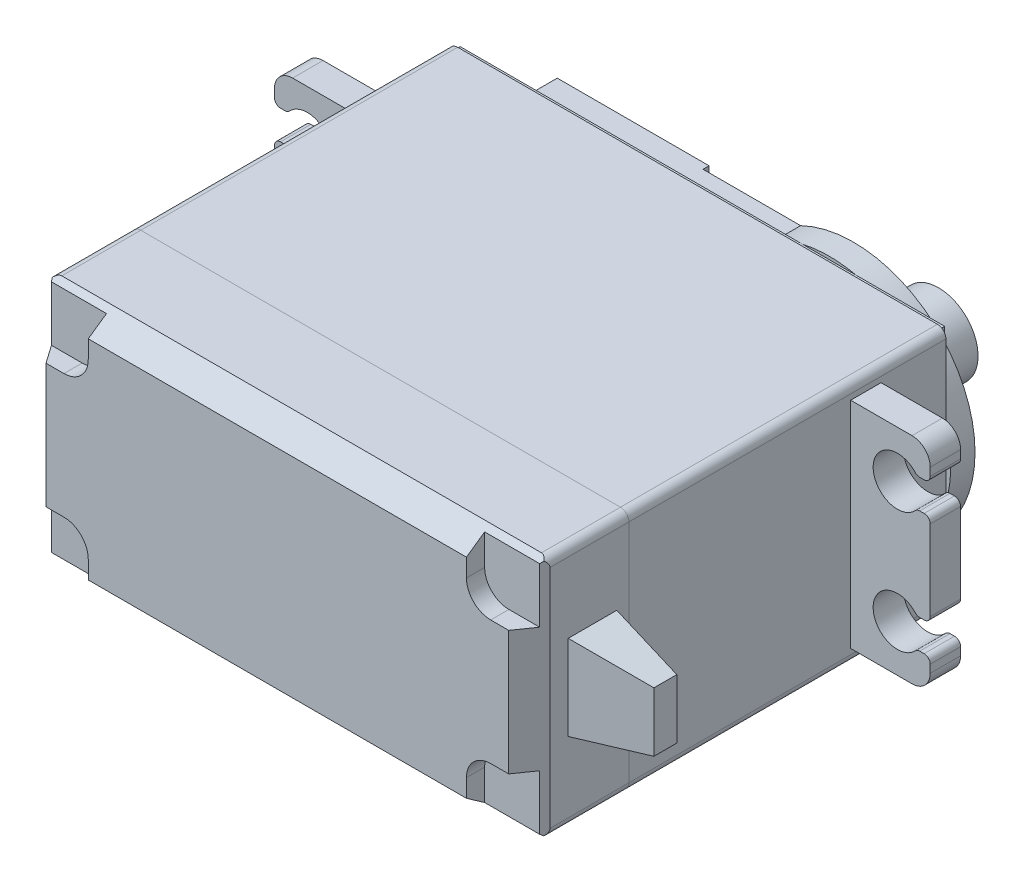
from build123d import *
from OCP.BRepFilletAPI import BRepFilletAPI_MakeChamfer

# Parameters (mm, degrees)
SKETCH1_W            = 40.9
SKETCH1_H            = 20
BOSS_EXTRUDE1_DEPTH  = 19.3
SKETCH3_W            = 40.9
SKETCH3_H            = 20
BOSS_EXTRUDE2_DEPTH  = 6.8
SKETCH4_W            = 40.9
SKETCH4_H            = 20
BOSS_EXTRUDE3_DEPTH  = 8.5
CHAMFER1_SIZE        = 2
CHAMFER1_SIZE2       = 1.400415076
CUT_EXTRUDE1_DEPTH   = 1.5
SKETCH6_W            = 39.9
SKETCH6_H            = 19.5
BOSS_EXTRUDE4_DEPTH  = 0.4
BOSS_EXTRUDE5_DEPTH  = 2
SKETCH8_R            = 6.5
BOSS_EXTRUDE6_DEPTH  = 1.5
SKETCH9_R            = 5.5
BOSS_EXTRUDE8_DEPTH  = 0.5
SKETCH11_R           = 3.25
BOSS_EXTRUDE9_DEPTH  = 5
SKETCH12_W           = 10.5
SKETCH12_H           = 15.998933302
BOSS_EXTRUDE10_DEPTH = 0.5
FILLET1_R            = 0.7
FILLET2_R            = 0.7
FILLET3_R            = 0.7
BOSS_EXTRUDE11_START = -5.74
BOSS_EXTRUDE11_DEPTH = 2.5
SKETCH14_W           = 4
SKETCH14_H           = 7
BOSS_EXTRUDE12_DEPTH = 6
BOSS_EXTRUDE12_TAPER = 10


with BuildPart() as part:
    # Sketch1 → Boss-Extrude1 (new body)
    with BuildSketch(Plane.XY):
        Rectangle(SKETCH1_W, SKETCH1_H)
    extrude(amount=BOSS_EXTRUDE1_DEPTH)

    # Fillet1
    fillet1_edges = [part.edges().sort_by_distance(p)[0] for p in [
        (-20.45, 10, 9.65),
        (20.45, 10, 9.65),
        (20.45, -10, 9.65),
        (-20.45, -10, 9.65),
    ]]
    fillet(fillet1_edges, radius=FILLET1_R)



with BuildPart() as body_2:
    # Sketch3 → Boss-Extrude2 (new body)
    with BuildSketch(Plane(origin=(0, 0, 0), x_dir=(-1, 0, 0), z_dir=(0, 0, -1))):
        Rectangle(SKETCH3_W, SKETCH3_H)
    extrude(amount=BOSS_EXTRUDE2_DEPTH)

    # Sketch6 → Boss-Extrude4 (add)
    with BuildSketch(Plane(origin=(0, 0, -6.8), x_dir=(-1, 0, 0), z_dir=(0, 0, -1))):
        Rectangle(SKETCH6_W, SKETCH6_H)
    extrude(amount=BOSS_EXTRUDE4_DEPTH)

    # Sketch7 → Boss-Extrude5 (add)
    with BuildSketch(Plane(origin=(0, 0, -7.2), x_dir=(-1, 0, 0), z_dir=(0, 0, -1))):
        with BuildLine():
            Line((-6.09, 8.999466651), (14.45, 8.999466651))
            Line((14.45, 8.999466651), (14.45, 3))
            ThreePointArc((14.45, 3), (17.45, 0), (14.45, -3))
            Line((14.45, -3), (14.45, -8.999466651))
            Line((14.45, -8.999466651), (-6.09, -8.999466651))
            ThreePointArc((-6.09, -8.999466651), (-20.45, 0), (-6.09, 8.999466651))
        make_face()
    extrude(amount=BOSS_EXTRUDE5_DEPTH)

    # Sketch8 → Boss-Extrude6 (add)
    with BuildSketch(Plane(origin=(0, 0, -9.2), x_dir=(-1, 0, 0), z_dir=(0, 0, -1))):
        with Locations((-10.45, 0)):
            Circle(SKETCH8_R)
    extrude(amount=BOSS_EXTRUDE6_DEPTH)

    # Sketch9 → Boss-Extrude8 (add)
    with BuildSketch(Plane(origin=(0, 0, -10.7), x_dir=(-1, 0, 0), z_dir=(0, 0, -1))):
        with Locations((-10.45, 0)):
            Circle(SKETCH9_R)
    extrude(amount=BOSS_EXTRUDE8_DEPTH)

    # Sketch11 → Boss-Extrude9 (add)
    with BuildSketch(Plane(origin=(0, 0, -11.2), x_dir=(-1, 0, 0), z_dir=(0, 0, -1))):
        with Locations((-10.45, 0)):
            Circle(SKETCH11_R)
    extrude(amount=BOSS_EXTRUDE9_DEPTH)

    # Sketch12 → Boss-Extrude10 (add)
    with BuildSketch(Plane(origin=(0, 0, -9.2), x_dir=(-1, 0, 0), z_dir=(0, 0, -1))):
        with BuildLine():
            Line((14.45, 8.999466651), (1.95, 8.999466651))
            Line((1.95, 8.999466651), (1.95, 1.75))
            ThreePointArc((1.95, 1.75), (0.2, 0), (1.95, -1.75))
            Line((1.95, -1.75), (1.95, -8.999466651))
            Line((1.95, -8.999466651), (14.45, -8.999466651))
            Line((14.45, -8.999466651), (14.45, 8.999466651))
        make_face()
        with Locations((8.2, 0)):
            Rectangle(SKETCH12_W, SKETCH12_H, mode=Mode.SUBTRACT)
    extrude(amount=BOSS_EXTRUDE10_DEPTH)

    # Fillet2
    fillet2_edges = [body_2.edges().sort_by_distance(p)[0] for p in [
        (20.45, -10, -3.4),
        (20.45, 10, -3.4),
        (-20.45, 10, -3.4),
        (-20.45, -10, -3.4),
    ]]
    fillet(fillet2_edges, radius=FILLET2_R)


with BuildPart() as body_3:
    # Sketch4 → Boss-Extrude3 (new body)
    with BuildSketch(Plane.XY.offset(19.3)):
        Rectangle(SKETCH4_W, SKETCH4_H)
    extrude(amount=BOSS_EXTRUDE3_DEPTH)

    # Chamfer1: one chamfer whose edges measure the first distance from different faces: ONE call of the kernel's chamfer builder (chamfer() names one face for all edges)
    chamfer1_edges_1 = [body_3.edges().sort_by_distance(p)[0] for p in [
        (0, -10, 27.8),
    ]]
    chamfer1_side_1 = [body_3.faces().sort_by_distance(p)[0] for p in [
        (0, -10, 23.55),
    ]]
    chamfer1_edges_2 = [body_3.edges().sort_by_distance(p)[0] for p in [
        (20.45, 0, 27.8),
    ]]
    chamfer1_side_2 = [body_3.faces().sort_by_distance(p)[0] for p in [
        (20.45, 0, 23.55),
    ]]
    chamfer1_edges_3 = [body_3.edges().sort_by_distance(p)[0] for p in [
        (0, 10, 27.8),
    ]]
    chamfer1_side_3 = [body_3.faces().sort_by_distance(p)[0] for p in [
        (0, 10, 23.55),
    ]]
    chamfer1_edges_4 = [body_3.edges().sort_by_distance(p)[0] for p in [
        (-20.45, 0, 27.8),
    ]]
    chamfer1_side_4 = [body_3.faces().sort_by_distance(p)[0] for p in [
        (-20.45, 0, 23.55),
    ]]
    chamfer1 = BRepFilletAPI_MakeChamfer(body_3.part.solid().wrapped)
    for e in chamfer1_edges_1:
        chamfer1.Add(CHAMFER1_SIZE, CHAMFER1_SIZE2, e.wrapped, chamfer1_side_1[0].wrapped)  # the first distance lies on this face
    for e in chamfer1_edges_2:
        chamfer1.Add(CHAMFER1_SIZE, CHAMFER1_SIZE2, e.wrapped, chamfer1_side_2[0].wrapped)  # the first distance lies on this face
    for e in chamfer1_edges_3:
        chamfer1.Add(CHAMFER1_SIZE, CHAMFER1_SIZE2, e.wrapped, chamfer1_side_3[0].wrapped)  # the first distance lies on this face
    for e in chamfer1_edges_4:
        chamfer1.Add(CHAMFER1_SIZE, CHAMFER1_SIZE2, e.wrapped, chamfer1_side_4[0].wrapped)  # the first distance lies on this face
    add(Compound.cast(chamfer1.Shape()), mode=Mode.REPLACE)

    # Sketch5 → Cut-Extrude1 (cut)
    with BuildSketch(Plane.XY.offset(27.8)):
        with BuildLine():
            Line((-20.45, 10), (-15.57, 10))
            Line((-15.57, 10), (-15.57, 7.12))
            ThreePointArc((-15.57, 7.12), (-16.155786438, 5.705786438), (-17.57, 5.12))
            Line((-17.57, 5.12), (-20.45, 5.12))
            Line((-20.45, 5.12), (-20.45, 10))
        make_face()
        with BuildLine():
            Line((20.45, 5.12), (17.57, 5.12))
            ThreePointArc((17.57, 5.12), (16.155786438, 5.705786438), (15.57, 7.12))
            Line((15.57, 7.12), (15.57, 10))
            Line((15.57, 10), (20.45, 10))
            Line((20.45, 10), (20.45, 5.12))
        make_face()
        with BuildLine():
            Line((-20.45, -5.12), (-17.57, -5.12))
            ThreePointArc((-17.57, -5.12), (-16.155786438, -5.705786438), (-15.57, -7.12))
            Line((-15.57, -7.12), (-15.57, -10))
            Line((-15.57, -10), (-20.45, -10))
            Line((-20.45, -10), (-20.45, -5.12))
        make_face()
        with BuildLine():
            Line((20.45, -10), (20.45, -5.12))
            Line((20.45, -5.12), (17.57, -5.12))
            ThreePointArc((17.57, -5.12), (16.155786438, -5.705786438), (15.57, -7.12))
            Line((15.57, -7.12), (15.57, -10))
            Line((15.57, -10), (20.45, -10))
        make_face()
    extrude(amount=-CUT_EXTRUDE1_DEPTH, mode=Mode.SUBTRACT)

    # Fillet3
    fillet3_edges = [body_3.edges().sort_by_distance(p)[0] for p in [
        (20.45, 10, 22.55),
        (20.45, -10, 22.55),
        (-20.45, -10, 22.55),
        (-20.45, 10, 22.55),
    ]]
    fillet(fillet3_edges, radius=FILLET3_R)

    # Sketch14 → Boss-Extrude12 (add)
    with BuildSketch(Plane(origin=(20.45, 0, 0), x_dir=(0, 0, -1), z_dir=(1, 0, 0))):
        with Locations((-22.3, 0)):
            Rectangle(SKETCH14_W, SKETCH14_H)
    extrude(amount=BOSS_EXTRUDE12_DEPTH, taper=BOSS_EXTRUDE12_TAPER)


with BuildPart() as part_1:
    add(part.part)

    add(body_2.part)  # Boss-Extrude11 merges body 2
    # Sketch13 → Boss-Extrude11 (add)
    with BuildSketch(Plane(origin=(0, 0, -7.2), x_dir=(-1, 0, 0), z_dir=(0, 0, -1)).offset(BOSS_EXTRUDE11_START)):
        with BuildLine():
            Line((20.45, 8.85), (25.5, 8.85))
            ThreePointArc((25.5, 8.85), (26.560660172, 8.410660172), (27, 7.35))
            Line((27, 7.35), (27, 6.7))
            ThreePointArc((27, 6.7), (26.853553391, 6.346446609), (26.5, 6.2))
            Line((26.5, 6.2), (26.133030278, 6.2))
            ThreePointArc((26.133030278, 6.2), (25.933030278, 6.241742431), (25.766424222, 6.36))
            ThreePointArc((25.766424222, 6.36), (22.3, 5), (25.766424222, 3.64))
            ThreePointArc((25.766424222, 3.64), (25.933030278, 3.758257569), (26.133030278, 3.8))
            Line((26.133030278, 3.8), (26.5, 3.8))
            ThreePointArc((26.5, 3.8), (26.853553391, 3.653553391), (27, 3.3))
            Line((27, 3.3), (27, -3.3))
            ThreePointArc((27, -3.3), (26.853553391, -3.653553391), (26.5, -3.8))
            Line((26.5, -3.8), (26.133030278, -3.8))
            ThreePointArc((26.133030278, -3.8), (25.933030278, -3.758257569), (25.766424222, -3.64))
            ThreePointArc((25.766424222, -3.64), (22.3, -5), (25.766424222, -6.36))
            ThreePointArc((25.766424222, -6.36), (25.933030278, -6.241742431), (26.133030278, -6.2))
            Line((26.133030278, -6.2), (26.5, -6.2))
            ThreePointArc((26.5, -6.2), (26.853553391, -6.346446609), (27, -6.7))
            Line((27, -6.7), (27, -7.35))
            ThreePointArc((27, -7.35), (26.560660172, -8.410660172), (25.5, -8.85))
            Line((25.5, -8.85), (20.45, -8.85))
            Line((20.45, -8.85), (20.45, 8.85))
        make_face()
    boss_extrude11 = extrude(amount=-BOSS_EXTRUDE11_DEPTH)

    # Mirror1: Boss-Extrude11 across plane
    add(boss_extrude11.mirror(Plane(origin=(0, 0, 0), x_dir=(0, 0, 1), z_dir=(1, 0, 0))))


solid = Compound([body_3.part, part_1.part])
